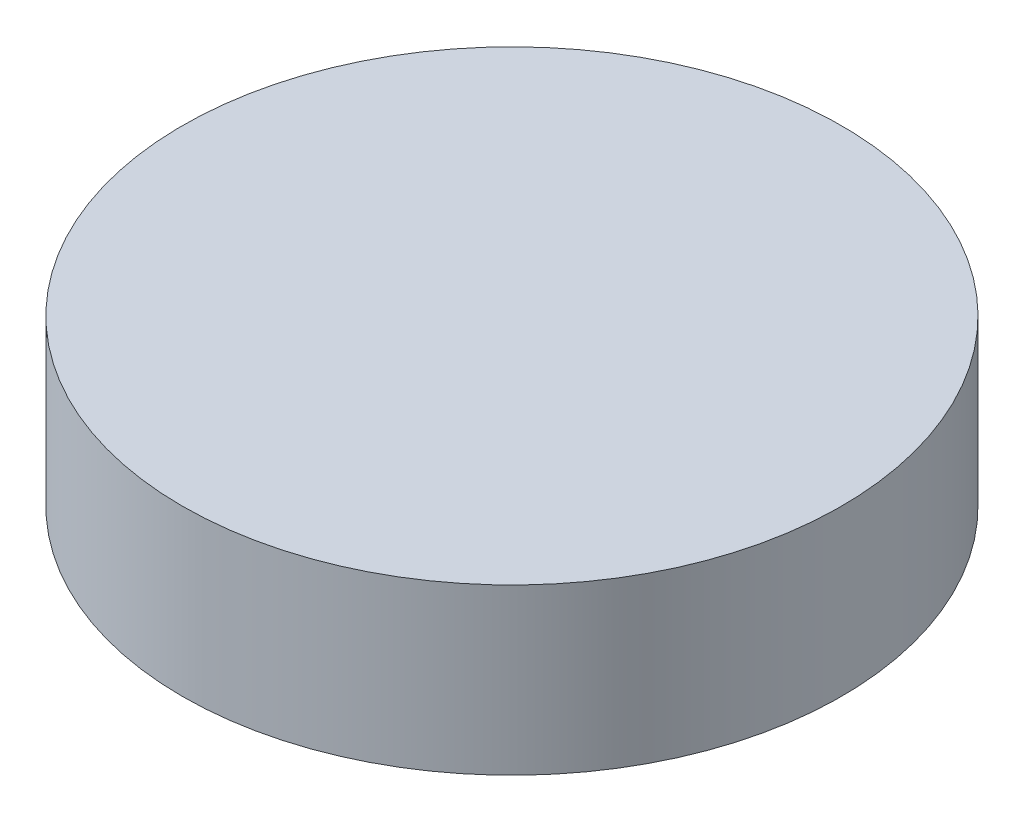
from build123d import *

# Parameters (mm, degrees)
SCHIZZO1_R                   = 1
ESTRUSIONE_ESTRUSIONE1_DEPTH = 0.5


with BuildPart() as part:
    # Schizzo1 → Estrusione-Estrusione1 (new body)
    with BuildSketch(Plane(origin=(0, 0, 0), x_dir=(1, 0, 0), z_dir=(0, 1, 0))):
        Circle(SCHIZZO1_R)
    extrude(amount=ESTRUSIONE_ESTRUSIONE1_DEPTH)


solid = part.part
